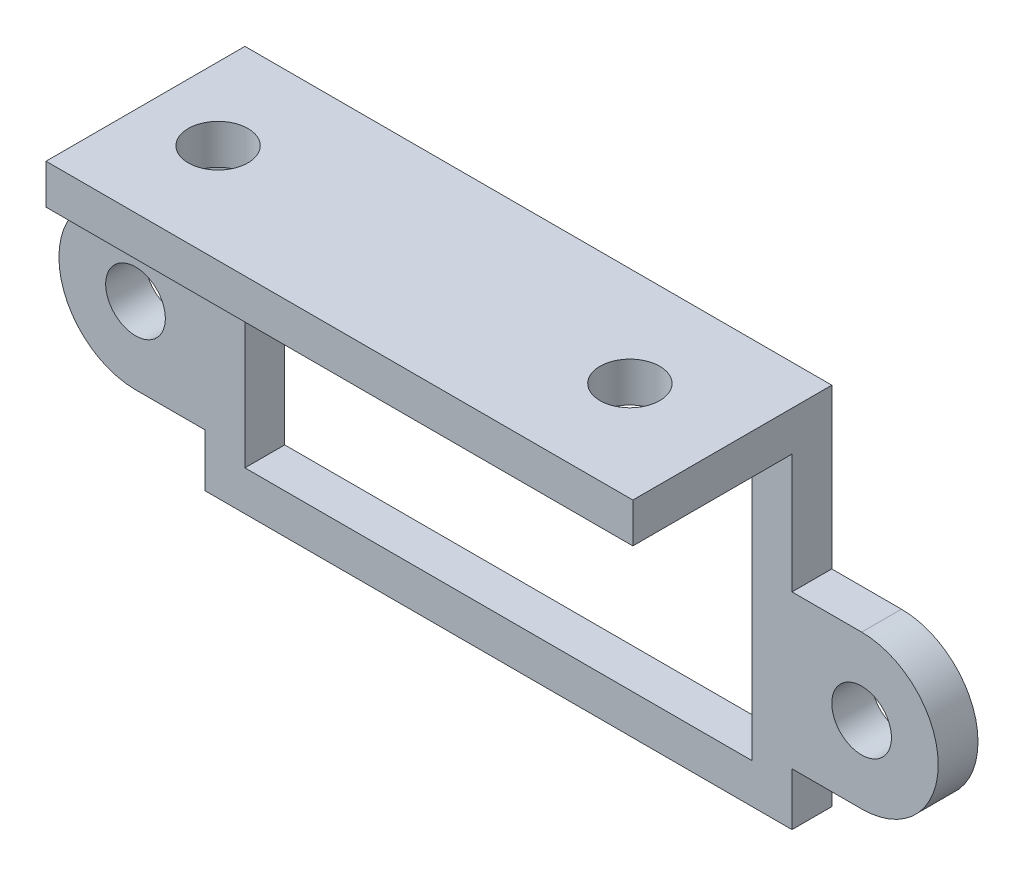
from build123d import *

# Parameters (mm, degrees)
SKETCH1_R           = 1.5
SKETCH1_W           = 25.5
SKETCH1_H           = 14.35
BOSS_EXTRUDE1_DEPTH = 2
SKETCH2_W           = 29.5
SKETCH2_H           = 2
BOSS_EXTRUDE2_DEPTH = 8
SKETCH3_R           = 1.5
CUT_EXTRUDE1_DEPTH  = 8


with BuildPart() as part:
    # Sketch1 → Boss-Extrude1 (new body)
    with BuildSketch(Plane.XY):
        with BuildLine():
            Line((0, 18.35), (0, 10.35))
            Line((0, 10.35), (-3.5, 10.35))
            ThreePointArc((-3.5, 10.35), (-7.35, 6.5), (-3.5, 2.65))
            Line((-3.5, 2.65), (0, 2.65))
            Line((0, 2.65), (0, 0))
            Line((0, 0), (29.5, 0))
            Line((29.5, 0), (29.5, 2.65))
            Line((29.5, 2.65), (33, 2.65))
            ThreePointArc((33, 2.65), (36.85, 6.5), (33, 10.35))
            Line((33, 10.35), (29.5, 10.35))
            Line((29.5, 10.35), (29.5, 18.35))
            Line((29.5, 18.35), (0, 18.35))
        make_face()
        with Locations((-3.5, 6.5)):
            Circle(SKETCH1_R, mode=Mode.SUBTRACT)
        with Locations(Location((33, 6.5, 0), (0, 0, 180))):
            Circle(SKETCH1_R, mode=Mode.SUBTRACT)
        with Locations((14.75, 9.175)):
            Rectangle(SKETCH1_W, SKETCH1_H, mode=Mode.SUBTRACT)
    extrude(amount=BOSS_EXTRUDE1_DEPTH)

    # Sketch2 → Boss-Extrude2 (add)
    with BuildSketch(Plane.XY.offset(2)):
        with Locations((14.75, 17.35)):
            Rectangle(SKETCH2_W, SKETCH2_H)
    extrude(amount=BOSS_EXTRUDE2_DEPTH)

    # Sketch3 → Cut-Extrude1 (cut)
    with BuildSketch(Plane(origin=(0, 18.35, 0), x_dir=(1, 0, 0), z_dir=(0, 1, 0))):
        with Locations(Location((3.65, -5, 0), (0, 0, 180))):
            Circle(SKETCH3_R)
        with Locations(Location((24.35, -5, 0), (0, 0, 180))):
            Circle(SKETCH3_R)
    extrude(amount=-CUT_EXTRUDE1_DEPTH, mode=Mode.SUBTRACT)


solid = part.part
